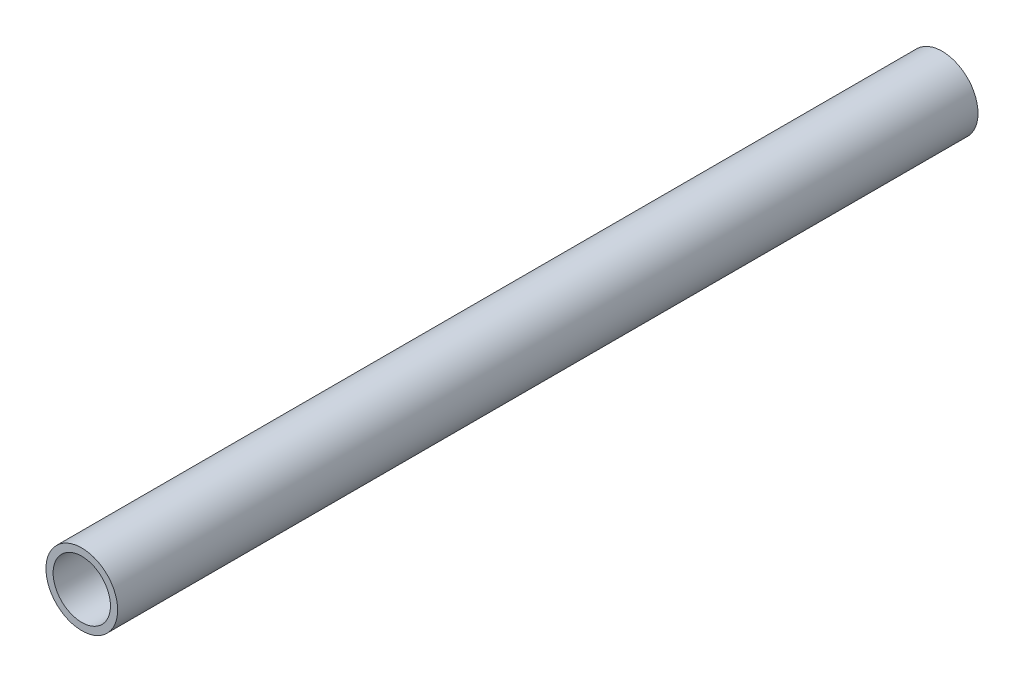
from build123d import *

# Parameters (mm, degrees)
SZKIC1_R                    = 5
SZKIC1_R_2                  = 4
DODANIE_WYCI_GNI_CIE1_DEPTH = 120


with BuildPart() as part:
    # Szkic1 → Dodanie-wyciągnięcie1 (new body)
    with BuildSketch(Plane.XY):
        Circle(SZKIC1_R)
        Circle(SZKIC1_R_2, mode=Mode.SUBTRACT)
    extrude(amount=DODANIE_WYCI_GNI_CIE1_DEPTH)


solid = part.part
